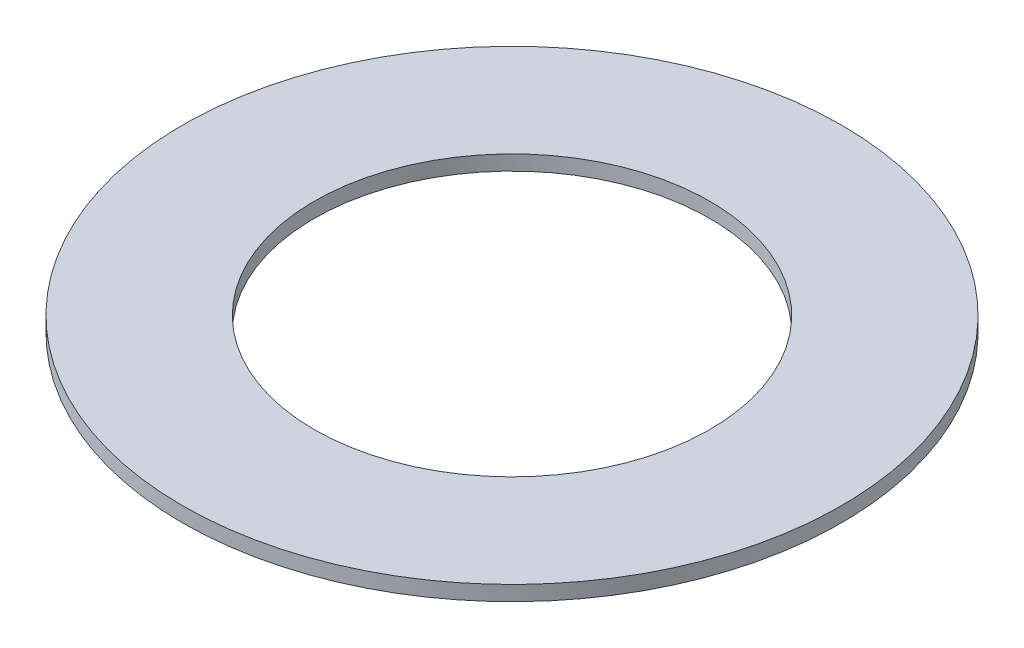
from build123d import *

# Parameters (mm, degrees)
SKETCH1_R           = 66.247678987
SKETCH1_R_2         = 39.762100618
BOSS_EXTRUDE1_DEPTH = 3


with BuildPart() as part:
    # Sketch1 → Boss-Extrude1 (new body)
    with BuildSketch(Plane(origin=(0, 0, 0), x_dir=(1, 0, 0), z_dir=(0, 1, 0))):
        with Locations(Location((0, 0, 0), (0, 0, 270))):
            Circle(SKETCH1_R)
        with Locations(Location((0, 0, 0), (0, 0, 270))):
            Circle(SKETCH1_R_2, mode=Mode.SUBTRACT)
    extrude(amount=BOSS_EXTRUDE1_DEPTH)


solid = part.part
